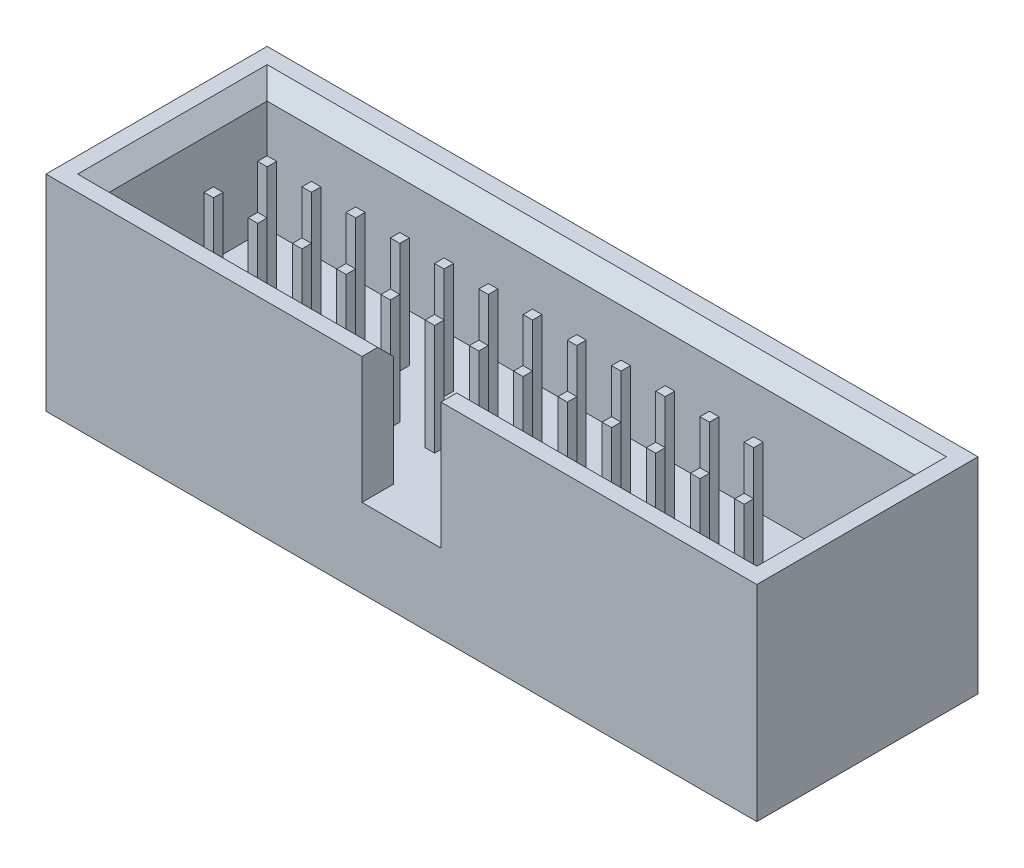
from build123d import *

# Parameters (mm, degrees)
SKETCH1_W           = 22.5
SKETCH1_H           = 7
BASE_DEPTH          = 2.5
RIMS_DEPTH          = 4
CHAMFER1_SIZE       = 0.5
SKETCH3_W           = 0.3
SKETCH3_H           = 0.3
BOSS_EXTRUDE3_DEPTH = 3.5


with BuildPart() as part:
    # Sketch1 → Base (new body)
    with BuildSketch(Plane(origin=(0, 0, 0), x_dir=(1, 0, 0), z_dir=(0, 1, 0))):
        Rectangle(SKETCH1_W, SKETCH1_H)
    extrude(amount=BASE_DEPTH)

    # Sketch2 → rims (add)
    with BuildSketch(Plane(origin=(0, 2.5, 0), x_dir=(1, 0, 0), z_dir=(0, 1, 0))):
        Polygon((-1.25, -2.5), (-1.25, -3.5), (-11.25, -3.5), (-11.25, 3.5), (11.25, 3.5), (11.25, -3.5), (1.25, -3.5), (1.25, -2.5), (10.25, -2.5), (10.25, 2.5), (-10.25, 2.5), (-10.25, -2.5), align=None)
    extrude(amount=RIMS_DEPTH)

    # Chamfer1
    chamfer1_edges = [part.edges().sort_by_distance(p)[0] for p in [
        (-5.75, 6.5, 2.5),
        (-10.25, 6.5, 0),
        (0, 6.5, -2.5),
        (10.25, 6.5, 0),
        (5.75, 6.5, 2.5),
    ]]
    chamfer(chamfer1_edges, length=CHAMFER1_SIZE)

    # Sketch3 → Boss-Extrude3 (add)
    with BuildSketch(Plane(origin=(0, 2.5, 0), x_dir=(1, 0, 0), z_dir=(0, 1, 0))):
        with Locations((-8.6, -0.85)):
            Rectangle(SKETCH3_W, SKETCH3_H)
        with Locations((-8.6, 0.85)):
            Rectangle(SKETCH3_W, SKETCH3_H)
        with Locations((-7.2, -0.85)):
            Rectangle(SKETCH3_W, SKETCH3_H)
        with Locations((-5.8, -0.85)):
            Rectangle(SKETCH3_W, SKETCH3_H)
        with Locations((-4.4, -0.85)):
            Rectangle(SKETCH3_W, SKETCH3_H)
        with Locations((-3, -0.85)):
            Rectangle(SKETCH3_W, SKETCH3_H)
        with Locations((-1.6, -0.85)):
            Rectangle(SKETCH3_W, SKETCH3_H)
        with Locations((-0.2, -0.85)):
            Rectangle(SKETCH3_W, SKETCH3_H)
        with Locations((1.2, -0.85)):
            Rectangle(SKETCH3_W, SKETCH3_H)
        with Locations((2.6, -0.85)):
            Rectangle(SKETCH3_W, SKETCH3_H)
        with Locations((4, -0.85)):
            Rectangle(SKETCH3_W, SKETCH3_H)
        with Locations((5.4, -0.85)):
            Rectangle(SKETCH3_W, SKETCH3_H)
        with Locations((6.8, -0.85)):
            Rectangle(SKETCH3_W, SKETCH3_H)
        with Locations((8.2, -0.85)):
            Rectangle(SKETCH3_W, SKETCH3_H)
        with Locations((-7.2, 0.85)):
            Rectangle(SKETCH3_W, SKETCH3_H)
        with Locations((-5.8, 0.85)):
            Rectangle(SKETCH3_W, SKETCH3_H)
        with Locations((-4.4, 0.85)):
            Rectangle(SKETCH3_W, SKETCH3_H)
        with Locations((-3, 0.85)):
            Rectangle(SKETCH3_W, SKETCH3_H)
        with Locations((-1.6, 0.85)):
            Rectangle(SKETCH3_W, SKETCH3_H)
        with Locations((-0.2, 0.85)):
            Rectangle(SKETCH3_W, SKETCH3_H)
        with Locations((1.2, 0.85)):
            Rectangle(SKETCH3_W, SKETCH3_H)
        with Locations((2.6, 0.85)):
            Rectangle(SKETCH3_W, SKETCH3_H)
        with Locations((4, 0.85)):
            Rectangle(SKETCH3_W, SKETCH3_H)
        with Locations((5.4, 0.85)):
            Rectangle(SKETCH3_W, SKETCH3_H)
        with Locations((6.8, 0.85)):
            Rectangle(SKETCH3_W, SKETCH3_H)
    extrude(amount=BOSS_EXTRUDE3_DEPTH)


solid = part.part
